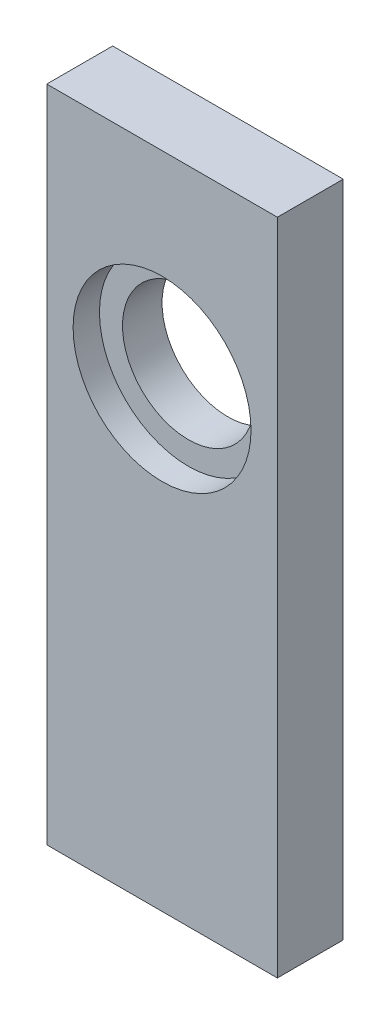
from build123d import *

# Parameters (mm, degrees)
BOSS_EXTRUDE1_DEPTH = 10
SKETCH4_R           = 13.5
CUT_EXTRUDE1_DEPTH  = 4
SKETCH5_R           = 10
CUT_EXTRUDE2_DEPTH  = 78.24797732


with BuildPart() as part:
    # Sketch1 → Boss-Extrude1 (new body)
    with BuildSketch(Plane.XY):
        Polygon((-17.5, 25), (-17.5, 75), (17.5, 75), (17.5, -25), (-17.5, -25), align=None)
    extrude(amount=BOSS_EXTRUDE1_DEPTH)

    # Sketch4 → Cut-Extrude1 (cut)
    with BuildSketch(Plane.XY.offset(10)):
        with Locations((0, 45)):
            Circle(SKETCH4_R)
    extrude(amount=-CUT_EXTRUDE1_DEPTH, mode=Mode.SUBTRACT)

    # Sketch5 → Cut-Extrude2 (cut, through all)
    with BuildSketch(Plane.XY.offset(6)):
        with Locations((0, 45)):
            Circle(SKETCH5_R)
    extrude(amount=-CUT_EXTRUDE2_DEPTH, mode=Mode.SUBTRACT)


solid = part.part
